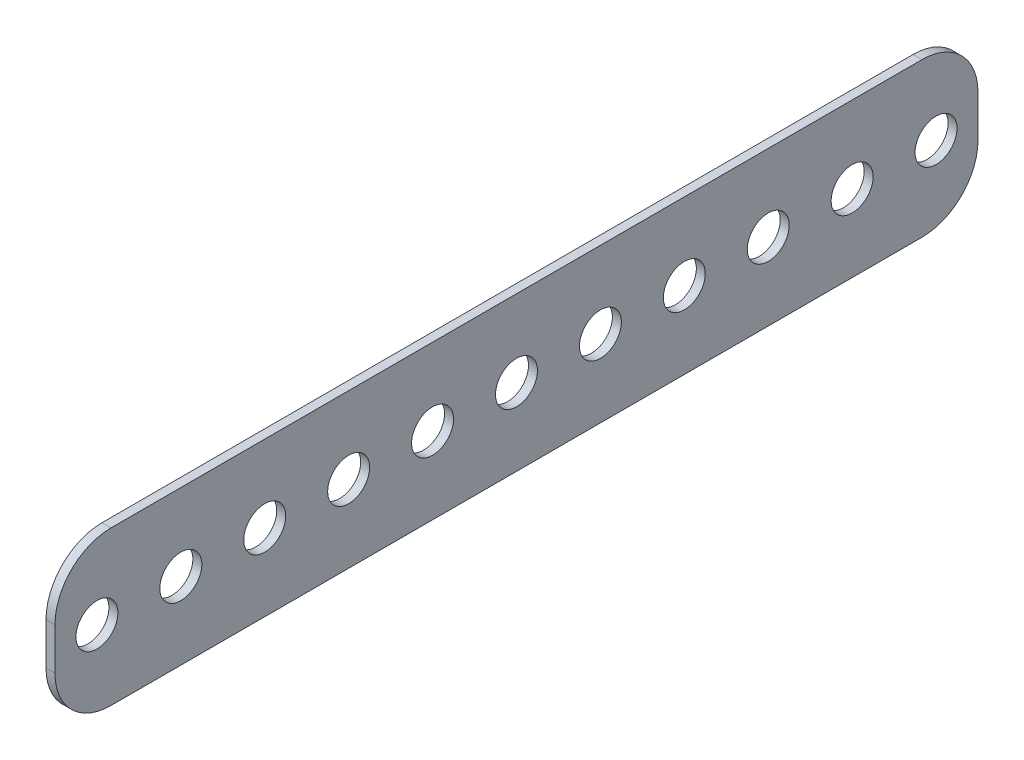
from build123d import *

# Parameters (mm, degrees)
SKETCH1_W           = 2.032
SKETCH1_H           = 34.925
BOSS_EXTRUDE1_DEPTH = 152.4
CUT_EXTRUDE1_REACH  = 158.364
SKETCH2_R           = 4.7625
LPATTERN1_COUNT     = 16
LPATTERN1_PITCH     = 19.05
SKETCH4_W           = 2.032
SKETCH4_H           = 34.925
CUT_EXTRUDE2_DEPTH  = 213.450199221
FILLET1_R           = 12.7


with BuildPart() as part:
    # Sketch1 → Boss-Extrude1 (new, symmetric)
    with BuildSketch(Plane.XY):
        with Locations((1.016, 17.4625)):
            Rectangle(SKETCH1_W, SKETCH1_H)
    extrude(amount=BOSS_EXTRUDE1_DEPTH, both=True)

    # Sketch2 → Cut-Extrude1 (cut, up to next)
    with BuildSketch(Plane.ZY, mode=Mode.PRIVATE) as cut_extrude1_sk1:
        with Locations((142.875, 17.4625)):
            Circle(SKETCH2_R)
    cut_extrude1_tool1 = extrude(cut_extrude1_sk1.sketch, amount=-CUT_EXTRUDE1_REACH, mode=Mode.PRIVATE) & part.part
    cut_extrude1 = cut_extrude1_tool1.solids().sort_by_distance((0, 17.4625, 142.875))[0]
    add(cut_extrude1, mode=Mode.SUBTRACT)

    # LPattern1: Cut-Extrude1 ×16
    with Locations(*[(0, 0, -i * LPATTERN1_PITCH) for i in range(1, LPATTERN1_COUNT)]):
        add(cut_extrude1, mode=Mode.SUBTRACT)

    # Sketch4 → Cut-Extrude2 (cut, through all)
    with BuildSketch(Plane.XY.offset(-57.15)):
        with Locations((1.016, 17.4625)):
            Rectangle(SKETCH4_W, SKETCH4_H)
    extrude(amount=-CUT_EXTRUDE2_DEPTH, mode=Mode.SUBTRACT)

    # Fillet1
    fillet1_edges = [part.edges().sort_by_distance(p)[0] for p in [
        (1.016, 34.925, 152.4),
        (1.016, 0, -57.15),
        (1.016, 34.925, -57.15),
        (1.016, 0, 152.4),
    ]]
    fillet(fillet1_edges, radius=FILLET1_R)


solid = part.part
